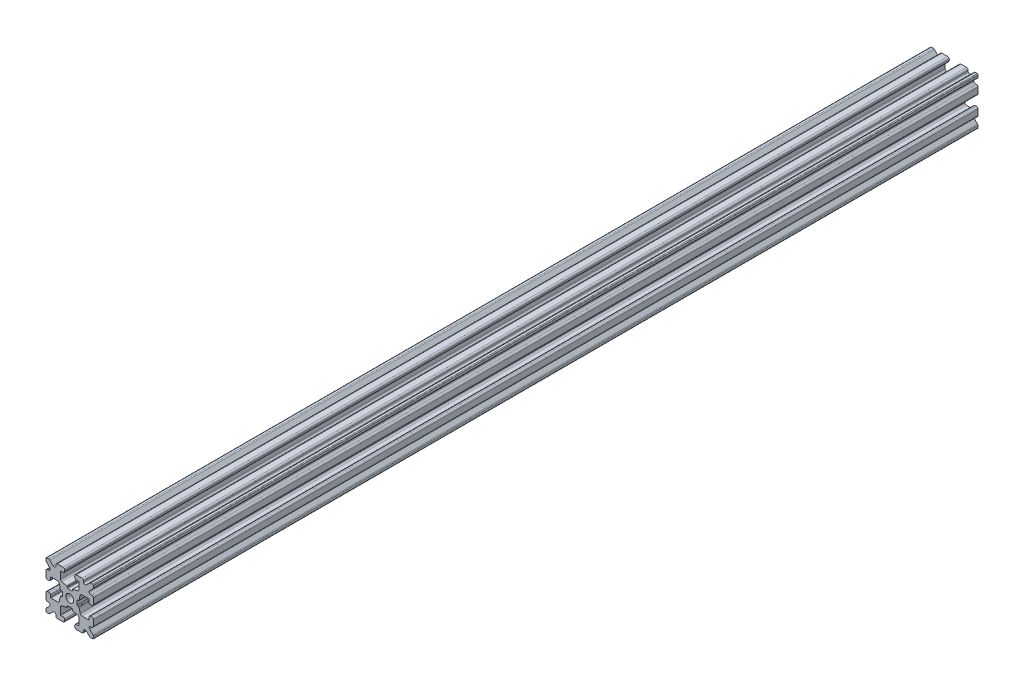
from build123d import *

# Parameters (mm, degrees)
SKETCH1_W           = 15
SKETCH1_H           = 15
SKETCH1_R           = 1.25
BOSS_EXTRUDE1_DEPTH = 140
FILLET1_R           = 0.25
CUT_EXTRUDE1_DEPTH  = 281.200820841
CUT_EXTRUDE3_DEPTH  = 281.200820841
FILLET3_R           = 0.5
FILLET4_R           = 0.5
FILLET5_R           = 3
FILLET6_R           = 0.2
CUT_EXTRUDE4_DEPTH  = 281.200820841
FILLET8_R           = 0.5
SKETCH6_W           = 5.1529354
SKETCH6_H           = 1.651
SKETCH6_W_2         = 1.651
SKETCH6_H_2         = 5.1529354
CUT_EXTRUDE5_DEPTH  = 281.200820841
FILLET10_R          = 0.2


with BuildPart() as part:
    # Sketch1 → Boss-Extrude1 (new, symmetric)
    with BuildSketch(Plane.XY):
        Rectangle(SKETCH1_W, SKETCH1_H)
        Circle(SKETCH1_R, mode=Mode.SUBTRACT)
    extrude(amount=BOSS_EXTRUDE1_DEPTH, both=True)

    # Fillet1
    fillet1_edges = [part.edges().sort_by_distance(p)[0] for p in [
        (7.5, -7.5, 0),
        (-7.5, -7.5, 0),
        (-7.5, 7.5, 0),
        (7.5, 7.5, 0),
    ]]
    fillet(fillet1_edges, radius=FILLET1_R)

    # Sketch2 → Cut-Extrude1 (cut, through all)
    with BuildSketch(Plane.XY.offset(140)):
        Polygon((-7.5, 1.6), (-6.1, 1.6), (-6.1, 2.9), (-3.4, 2.9), (-3.4, -2.9), (-6.1, -2.9), (-6.1, -1.6), (-7.5, -1.6), align=None)
        Polygon((2.9, 6.1), (1.6, 6.1), (1.6, 7.5), (-1.6, 7.5), (-1.6, 6.1), (-2.9, 6.1), (-2.9, 3.4), (2.9, 3.4), align=None)
        Polygon((-1.6, -7.5), (-1.6, -6.1), (-2.9, -6.1), (-2.9, -3.4), (2.9, -3.4), (2.9, -6.1), (1.6, -6.1), (1.6, -7.5), align=None)
        Polygon((6.1, -2.9), (6.1, -1.6), (7.5, -1.6), (7.5, 1.6), (6.1, 1.6), (6.1, 2.9), (3.4, 2.9), (3.4, -2.9), align=None)
    extrude(amount=-CUT_EXTRUDE1_DEPTH, mode=Mode.SUBTRACT)

    # Sketch4 → Cut-Extrude3 (cut, through all)
    with BuildSketch(Plane.XY.offset(140)):
        Polygon((-3.4, 2.9), (-2.75, 0), (-3.4, -2.9), align=None)
        Polygon((-2.9, 3.4), (0, 2.75), (2.9, 3.4), align=None)
        Polygon((3.4, 2.9), (2.75, 0), (3.4, -2.9), align=None)
        Polygon((-2.9, -3.4), (0, -2.75), (2.9, -3.4), align=None)
    extrude(amount=-CUT_EXTRUDE3_DEPTH, mode=Mode.SUBTRACT)

    # Fillet3
    fillet3_edges = [part.edges().sort_by_distance(p)[0] for p in [
        (1.6, -7.5, 0),
        (-1.6, -7.5, 0),
        (-1.6, -6.1, 0),
        (1.6, -6.1, 0),
        (6.1, 1.6, 0),
        (7.5, 1.6, 0),
        (7.5, -1.6, 0),
        (6.1, -1.6, 0),
        (-7.5, -1.6, 0),
        (-7.5, 1.6, 0),
        (-6.1, 1.6, 0),
        (-6.1, -1.6, 0),
        (-1.6, 6.1, 0),
        (-1.6, 7.5, 0),
        (1.6, 7.5, 0),
        (1.6, 6.1, 0),
    ]]
    fillet(fillet3_edges, radius=FILLET3_R)

    # Fillet4
    fillet4_edges = [part.edges().sort_by_distance(p)[0] for p in [
        (-2.9, -3.4, 0),
        (2.9, -3.4, 0),
        (3.4, -2.9, 0),
        (3.4, 2.9, 0),
        (-3.4, 2.9, 0),
        (-3.4, -2.9, 0),
        (2.9, 3.4, 0),
        (-2.9, 3.4, 0),
    ]]
    fillet(fillet4_edges, radius=FILLET4_R)

    # Fillet5
    fillet5_edges = [part.edges().sort_by_distance(p)[0] for p in [
        (-2.75, 0, 0),
        (0, 2.75, 0),
        (2.75, 0, 0),
        (0, -2.75, 0),
    ]]
    fillet(fillet5_edges, radius=FILLET5_R)

    # Fillet6
    fillet6_edges = [part.edges().sort_by_distance(p)[0] for p in [
        (-2.9, -6.1, 0),
        (2.9, -6.1, 0),
        (6.1, -2.9, 0),
        (6.1, 2.9, 0),
        (-6.1, 2.9, 0),
        (-6.1, -2.9, 0),
        (2.9, 6.1, 0),
        (-2.9, 6.1, 0),
    ]]
    fillet(fillet6_edges, radius=FILLET6_R)

    # Sketch5 → Cut-Extrude4 (cut, through all)
    with BuildSketch(Plane.XY.offset(140)):
        Polygon((-7.5, 6.439339828), (-5.460660172, 4.4), (-7.5, 4.4), align=None)
        Polygon((-6.439339828, 7.5), (-4.4, 5.460660172), (-4.4, 7.5), align=None)
        Polygon((4.4, 7.5), (6.439339828, 7.5), (4.4, 5.460660172), align=None)
        Polygon((7.5, 6.439339828), (7.5, 4.4), (5.460660172, 4.4), align=None)
        Polygon((7.5, -6.439339828), (5.460660172, -4.4), (7.5, -4.4), align=None)
        Polygon((6.439339828, -7.5), (4.4, -5.460660172), (4.4, -7.5), align=None)
        Polygon((-4.4, -7.5), (-6.439339828, -7.5), (-4.4, -5.460660172), align=None)
        Polygon((-7.5, -6.439339828), (-7.5, -4.4), (-5.460660172, -4.4), align=None)
    extrude(amount=-CUT_EXTRUDE4_DEPTH, mode=Mode.SUBTRACT)

    # Fillet8
    fillet8_edges = [part.edges().sort_by_distance(p)[0] for p in [
        (-7.5, 4.4, 0),
        (-7.5, 6.439339828, 0),
        (-5.460660172, 4.4, 0),
        (7.5, -4.4, 0),
        (7.5, -6.439339828, 0),
        (5.460660172, -4.4, 0),
        (5.460660172, 4.4, 0),
        (7.5, 6.439339828, 0),
        (7.5, 4.4, 0),
        (-4.4, 7.5, 0),
        (-4.4, 5.460660172, 0),
        (-6.439339828, 7.5, 0),
        (-5.460660172, -4.4, 0),
        (-7.5, -6.439339828, 0),
        (-7.5, -4.4, 0),
        (4.4, 5.460660172, 0),
        (4.4, 7.5, 0),
        (6.439339828, 7.5, 0),
        (6.439339828, -7.5, 0),
        (4.4, -7.5, 0),
        (4.4, -5.460660172, 0),
        (-6.439339828, -7.5, 0),
        (-4.4, -5.460660172, 0),
        (-4.4, -7.5, 0),
    ]]
    fillet(fillet8_edges, radius=FILLET8_R)

    # Sketch6 → Cut-Extrude5 (cut, through all)
    with BuildSketch(Plane.XY.offset(140)):
        with Locations((4.9235323, 0)):
            Rectangle(SKETCH6_W, SKETCH6_H)
        with Locations((0, -4.9235323)):
            Rectangle(SKETCH6_W_2, SKETCH6_H_2)
        with Locations((-4.9235323, 0)):
            Rectangle(SKETCH6_W, SKETCH6_H)
        with Locations((0, 4.9235323)):
            Rectangle(SKETCH6_W_2, SKETCH6_H_2)
    extrude(amount=-CUT_EXTRUDE5_DEPTH, mode=Mode.SUBTRACT)

    # Fillet10
    fillet10_edges = [part.edges().sort_by_distance(p)[0] for p in [
        (0.8255, -2.935025862, 0),
        (-0.8255, -2.935025862, 0),
        (0.8255, -2.3470646, 0),
        (-0.8255, -2.3470646, 0),
        (2.935025862, 0.8255, 0),
        (2.935025862, -0.8255, 0),
        (2.3470646, 0.8255, 0),
        (2.3470646, -0.8255, 0),
        (-2.935025862, -0.8255, 0),
        (-2.935025862, 0.8255, 0),
        (-2.3470646, -0.8255, 0),
        (-2.3470646, 0.8255, 0),
        (-0.8255, 2.935025862, 0),
        (0.8255, 2.935025862, 0),
        (-0.8255, 2.3470646, 0),
        (0.8255, 2.3470646, 0),
    ]]
    fillet(fillet10_edges, radius=FILLET10_R)


solid = part.part
